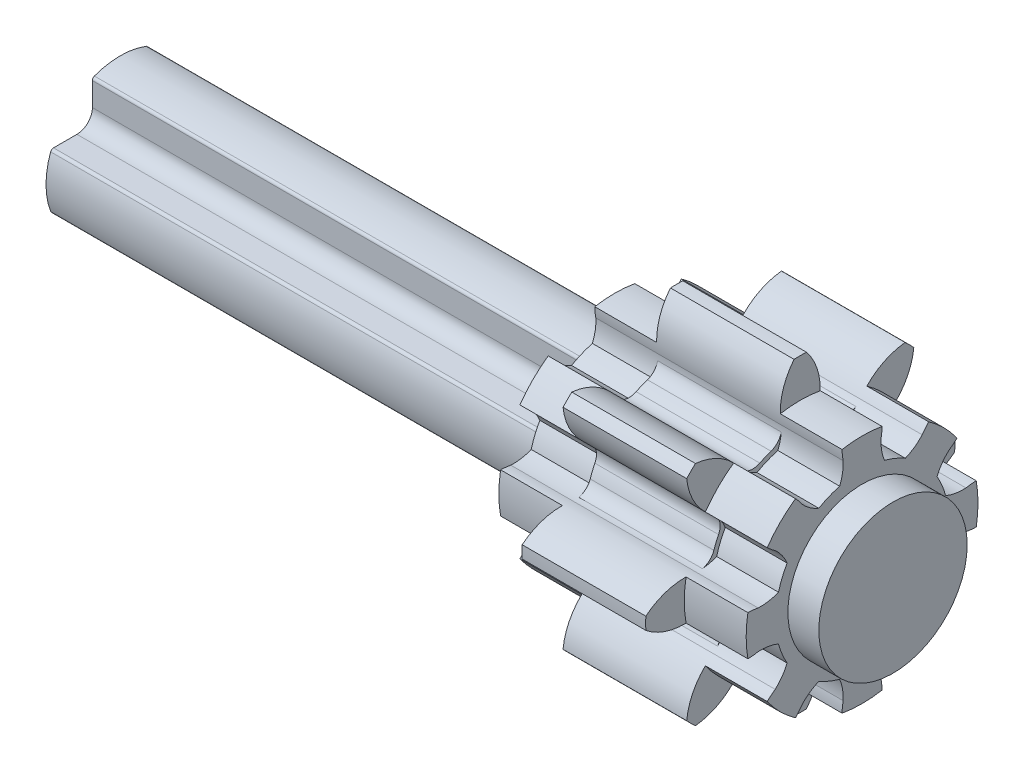
from build123d import *
from build123d.topology import SkipClean

# Parameters (mm, degrees)
CROQUIS1_R                      = 2.8
SALIENTE_EXTRUIR1_DEPTH         = 4
CROQUIS2_R                      = 2.95
CROQUIS2_R_2                    = 2.8
SALIENTE_EXTRUIR2_DEPTH         = 2
TOOTH_DEPTH                     = 2
REDONDEO1_R                     = 0.5
MATRIZ_TEETH_COUNT              = 8
REDONDEO1_OF_MATRIZ_TEETH_R     = 0.5
CROQUIS3_R                      = 2.4
CORTAR_EXTRUIR1_DEPTH           = 0.2
CORTAR_EXTRUIR2_START           = -0.2
CROQUIS4_R                      = 2.4
CORTAR_EXTRUIR2_DEPTH           = 0.2
BOSS_EXTRUDE1_REACH             = 10.124
BOSS_EXTRUDE1_DIRECTION_2_REACH = 10.124
CIRPATTERN1_COUNT               = 8
BOSS_EXTRUDE2_START             = 5
SKETCH2_R                       = 2.4
BOSS_EXTRUDE2_DEPTH             = 5
BOSS_EXTRUDE3_DEPTH             = 20


with BuildPart() as part:
    # Croquis1 → Saliente-Extruir1 (new, symmetric)
    with BuildSketch(Plane(origin=(0, 0, 0), x_dir=(0, 0, -1), z_dir=(1, 0, 0))):
        Circle(CROQUIS1_R)
        with BuildLine():
            Line((-1.4, 0.9), (-2.156385865, 0.9))
            ThreePointArc((-2.156385865, 0.9), (-2.213489889, 0.882092207), (-2.250141772, 0.834782609))
            ThreePointArc((-2.250141772, 0.834782609), (-2.4, 0), (-2.250141772, -0.834782609))
            ThreePointArc((-2.250141772, -0.834782609), (-2.213489889, -0.882092207), (-2.156385865, -0.9))
            Line((-2.156385865, -0.9), (-1.4, -0.9))
            ThreePointArc((-1.4, -0.9), (-1.046446609, -1.046446609), (-0.9, -1.4))
            Line((-0.9, -1.4), (-0.9, -2.156385865))
            ThreePointArc((-0.9, -2.156385865), (-0.882092207, -2.213489889), (-0.834782609, -2.250141772))
            ThreePointArc((-0.834782609, -2.250141772), (0, -2.4), (0.834782609, -2.250141772))
            ThreePointArc((0.834782609, -2.250141772), (0.882092207, -2.213489889), (0.9, -2.156385865))
            Line((0.9, -2.156385865), (0.9, -1.4))
            ThreePointArc((0.9, -1.4), (1.046446609, -1.046446609), (1.4, -0.9))
            Line((1.4, -0.9), (2.156385865, -0.9))
            ThreePointArc((2.156385865, -0.9), (2.213489889, -0.882092207), (2.250141772, -0.834782609))
            ThreePointArc((2.250141772, -0.834782609), (2.4, 0), (2.250141772, 0.834782609))
            ThreePointArc((2.250141772, 0.834782609), (2.213489889, 0.882092207), (2.156385865, 0.9))
            Line((2.156385865, 0.9), (1.4, 0.9))
            ThreePointArc((1.4, 0.9), (1.046446609, 1.046446609), (0.9, 1.4))
            Line((0.9, 1.4), (0.9, 2.156385865))
            ThreePointArc((0.9, 2.156385865), (0.882092207, 2.213489889), (0.834782609, 2.250141772))
            ThreePointArc((0.834782609, 2.250141772), (0, 2.4), (-0.834782609, 2.250141772))
            ThreePointArc((-0.834782609, 2.250141772), (-0.882092207, 2.213489889), (-0.9, 2.156385865))
            Line((-0.9, 2.156385865), (-0.9, 1.4))
            ThreePointArc((-0.9, 1.4), (-1.046446609, 1.046446609), (-1.4, 0.9))
        make_face(mode=Mode.SUBTRACT)
    extrude(amount=SALIENTE_EXTRUIR1_DEPTH, both=True)

    # Croquis2 → Saliente-Extruir2 (add, symmetric)
    with BuildSketch(Plane(origin=(0, 0, 0), x_dir=(0, 0, -1), z_dir=(1, 0, 0))):
        Circle(CROQUIS2_R)
        Circle(CROQUIS2_R_2, mode=Mode.SUBTRACT)
    extrude(amount=SALIENTE_EXTRUIR2_DEPTH, both=True)

    # Profile → Tooth (add, symmetric)
    with BuildSketch(Plane(origin=(0, 0, 0), x_dir=(0, 0, -1), z_dir=(1, 0, 0))):
        with BuildLine():
            ThreePointArc((0.2, 4.995998399), (0, 5), (-0.2, 4.995998399))
            ThreePointArc((-0.2, 4.995998399), (-0.639517045, 3.914162112), (-0.4, 2.771281292))
            ThreePointArc((-0.4, 2.771281292), (0, 2.8), (0.4, 2.771281292))
            ThreePointArc((0.4, 2.771281292), (0.639517045, 3.914162112), (0.2, 4.995998399))
        make_face()
    tooth = extrude(amount=TOOTH_DEPTH, both=True)

    # Redondeo1
    redondeo1_edges = [part.edges().sort_by_distance(p)[0] for p in [
        (0, 2.912247223, 0.470442465),
        (0, 2.912247223, -0.470442465),
    ]]
    fillet(redondeo1_edges, radius=REDONDEO1_R)

    # Matriz Teeth: Tooth ×8 about axis
    matriz_teeth_axis = Axis((0, 0, 0), (1, 0, 0))
    for i in range(1, MATRIZ_TEETH_COUNT):
        add(tooth.rotate(matriz_teeth_axis, i * 360 / MATRIZ_TEETH_COUNT))

    # Redondeo1 of Matriz Teeth
    redondeo1_of_matriz_teeth_edges = [part.edges().sort_by_distance(p)[0] for p in [
        (0, 1.726616703, 2.391922817),
        (0, 2.391922817, 1.726616703),
        (0, -0.470442465, 2.912247223),
        (0, 0.470442465, 2.912247223),
        (0, -2.391922817, 1.726616703),
        (0, -1.726616703, 2.391922817),
        (0, -2.912247223, -0.470442465),
        (0, -2.912247223, 0.470442465),
        (0, -1.726616703, -2.391922817),
        (0, -2.391922817, -1.726616703),
        (0, 0.470442465, -2.912247223),
        (0, -0.470442465, -2.912247223),
        (0, 2.391922817, -1.726616703),
        (0, 1.726616703, -2.391922817),
    ]]
    fillet(redondeo1_of_matriz_teeth_edges, radius=REDONDEO1_OF_MATRIZ_TEETH_R)

    # Croquis3 → Cortar-Extruir1 (cut)
    with BuildSketch(Plane(origin=(4, 0, 0), x_dir=(0, 0, -1), z_dir=(1, 0, 0))):
        with Locations(Location((0, 0, 0), (0, 0, 159.645593602))):
            Circle(CROQUIS3_R)
    extrude(amount=-CORTAR_EXTRUIR1_DEPTH, mode=Mode.SUBTRACT)

    # Croquis4 → Cortar-Extruir2 (cut)
    with SkipClean():  # the faces are left unmerged after this step: merging them gives an invalid solid
        with BuildSketch(Plane.ZY.offset(4).offset(CORTAR_EXTRUIR2_START)):
            with Locations(Location((0, 0, 0), (0, 0, 180))):
                Circle(CROQUIS4_R)
        extrude(amount=CORTAR_EXTRUIR2_DEPTH, mode=Mode.SUBTRACT)

    # Boss-Extrude1: up to this face of the body (flat: up to its plane)
    boss_extrude1_end = Plane(part.part.faces().sort_by_distance((4, 0, 2.720804041))[0])
    # Sketch1 → Boss-Extrude1 (add, up to the picked face)
    with BuildSketch(Plane(origin=(0, 0, 0), x_dir=(0, 0, -1), z_dir=(1, 0, 0)), mode=Mode.PRIVATE) as boss_extrude1_sk1:
        with BuildLine():
            Line((-0.724693326, 2.704592314), (-0.698811422, 2.607999731))
            ThreePointArc((-0.698811422, 2.607999731), (0, 2.7), (0.698811422, 2.607999731))
            Line((0.698811422, 2.607999731), (0.724693326, 2.704592314))
            ThreePointArc((0.724693326, 2.704592314), (0.631569302, 3.02696901), (0.612440148, 3.361980792))
            ThreePointArc((0.612440148, 3.361980792), (0.636710161, 3.527137205), (0.647122854, 3.693742277))
            ThreePointArc((0.647122854, 3.693742277), (0, 3.75), (-0.647122854, 3.693742277))
            ThreePointArc((-0.647122854, 3.693742277), (-0.636710161, 3.527137205), (-0.612440148, 3.361980792))
            ThreePointArc((-0.612440148, 3.361980792), (-0.631569302, 3.02696901), (-0.724693326, 2.704592314))
        make_face()
    boss_extrude1_tool1 = split(extrude(boss_extrude1_sk1.sketch, amount=BOSS_EXTRUDE1_REACH, mode=Mode.PRIVATE), bisect_by=boss_extrude1_end, keep=Keep.BOTH, mode=Mode.PRIVATE)
    boss_extrude1 = boss_extrude1_tool1.solids().sort_by(Axis((0, 3.191088, 0), (1, 0, 0)))[0]
    add(boss_extrude1)

    # Boss-Extrude1 direction 2: up to this face of the body (flat: up to its plane)
    boss_extrude1_direction_2_end = Plane(part.part.faces().sort_by_distance((-4, 0, 2.720804041))[0])
    # Sketch1 → Boss-Extrude1 direction 2 (add, up to the picked face)
    with BuildSketch(Plane(origin=(0, 0, 0), x_dir=(0, 0, -1), z_dir=(1, 0, 0)), mode=Mode.PRIVATE) as boss_extrude1_direction_2_sk1:
        with BuildLine():
            Line((-0.724693326, 2.704592314), (-0.698811422, 2.607999731))
            ThreePointArc((-0.698811422, 2.607999731), (0, 2.7), (0.698811422, 2.607999731))
            Line((0.698811422, 2.607999731), (0.724693326, 2.704592314))
            ThreePointArc((0.724693326, 2.704592314), (0.631569302, 3.02696901), (0.612440148, 3.361980792))
            ThreePointArc((0.612440148, 3.361980792), (0.636710161, 3.527137205), (0.647122854, 3.693742277))
            ThreePointArc((0.647122854, 3.693742277), (0, 3.75), (-0.647122854, 3.693742277))
            ThreePointArc((-0.647122854, 3.693742277), (-0.636710161, 3.527137205), (-0.612440148, 3.361980792))
            ThreePointArc((-0.612440148, 3.361980792), (-0.631569302, 3.02696901), (-0.724693326, 2.704592314))
        make_face()
    boss_extrude1_direction_2_tool1 = split(extrude(boss_extrude1_direction_2_sk1.sketch, amount=-BOSS_EXTRUDE1_DIRECTION_2_REACH, mode=Mode.PRIVATE), bisect_by=boss_extrude1_direction_2_end, keep=Keep.BOTH, mode=Mode.PRIVATE)
    boss_extrude1_direction_2 = boss_extrude1_direction_2_tool1.solids().sort_by(Axis((0, 3.191088, 0), (-1, 0, 0)))[0]
    add(boss_extrude1_direction_2)

    # CirPattern1: Boss-Extrude1, Boss-Extrude1 direction 2 ×8 about axis
    with SkipClean():  # the faces are left unmerged after this step: merging them gives an invalid solid
        cirpattern1_axis = Axis((0, 0, 0), (1, 0, 0))
        add([boss_extrude1.rotate(cirpattern1_axis, i * 360 / CIRPATTERN1_COUNT) for i in range(1, CIRPATTERN1_COUNT)])
        add([boss_extrude1_direction_2.rotate(cirpattern1_axis, i * 360 / CIRPATTERN1_COUNT) for i in range(1, CIRPATTERN1_COUNT)])

    # Sketch2 → Boss-Extrude2 (add)
    with SkipClean():  # the faces are left unmerged after this step: merging them gives an invalid solid
        with BuildSketch(Plane(origin=(0, 0, 0), x_dir=(0, 0, -1), z_dir=(1, 0, 0)).offset(BOSS_EXTRUDE2_START)):
            with Locations(Location((0, 0, 0), (0, 0, 200.354406398))):
                Circle(SKETCH2_R)
        extrude(amount=-BOSS_EXTRUDE2_DEPTH)

    # Sketch3 → Boss-Extrude3 (add)
    with BuildSketch(Plane.ZY):
        with BuildLine():
            Line((-0.9, 2.156385865), (-0.9, 1.4))
            ThreePointArc((-0.9, 1.4), (-1.046446609, 1.046446609), (-1.4, 0.9))
            Line((-1.4, 0.9), (-2.156385865, 0.9))
            ThreePointArc((-2.156385865, 0.9), (-2.213489889, 0.882092207), (-2.250141772, 0.834782609))
            ThreePointArc((-2.250141772, 0.834782609), (-2.4, 0), (-2.250141772, -0.834782609))
            ThreePointArc((-2.250141772, -0.834782609), (-2.213489889, -0.882092207), (-2.156385865, -0.9))
            Line((-2.156385865, -0.9), (-1.4, -0.9))
            ThreePointArc((-1.4, -0.9), (-1.046446609, -1.046446609), (-0.9, -1.4))
            Line((-0.9, -1.4), (-0.9, -2.156385865))
            ThreePointArc((-0.9, -2.156385865), (-0.882092207, -2.213489889), (-0.834782609, -2.250141772))
            ThreePointArc((-0.834782609, -2.250141772), (0, -2.4), (0.834782609, -2.250141772))
            ThreePointArc((0.834782609, -2.250141772), (0.882092207, -2.213489889), (0.9, -2.156385865))
            Line((0.9, -2.156385865), (0.9, -1.4))
            ThreePointArc((0.9, -1.4), (1.046446609, -1.046446609), (1.4, -0.9))
            Line((1.4, -0.9), (2.156385865, -0.9))
            ThreePointArc((2.156385865, -0.9), (2.213489889, -0.882092207), (2.250141772, -0.834782609))
            ThreePointArc((2.250141772, -0.834782609), (2.4, 0), (2.250141772, 0.834782609))
            ThreePointArc((2.250141772, 0.834782609), (2.213489889, 0.882092207), (2.156385865, 0.9))
            Line((2.156385865, 0.9), (1.4, 0.9))
            ThreePointArc((1.4, 0.9), (1.046446609, 1.046446609), (0.9, 1.4))
            Line((0.9, 1.4), (0.9, 2.156385865))
            ThreePointArc((0.9, 2.156385865), (0.882092207, 2.213489889), (0.834782609, 2.250141772))
            ThreePointArc((0.834782609, 2.250141772), (0, 2.4), (-0.834782609, 2.250141772))
            ThreePointArc((-0.834782609, 2.250141772), (-0.882092207, 2.213489889), (-0.9, 2.156385865))
        make_face()
    extrude(amount=BOSS_EXTRUDE3_DEPTH)


solid = part.part
